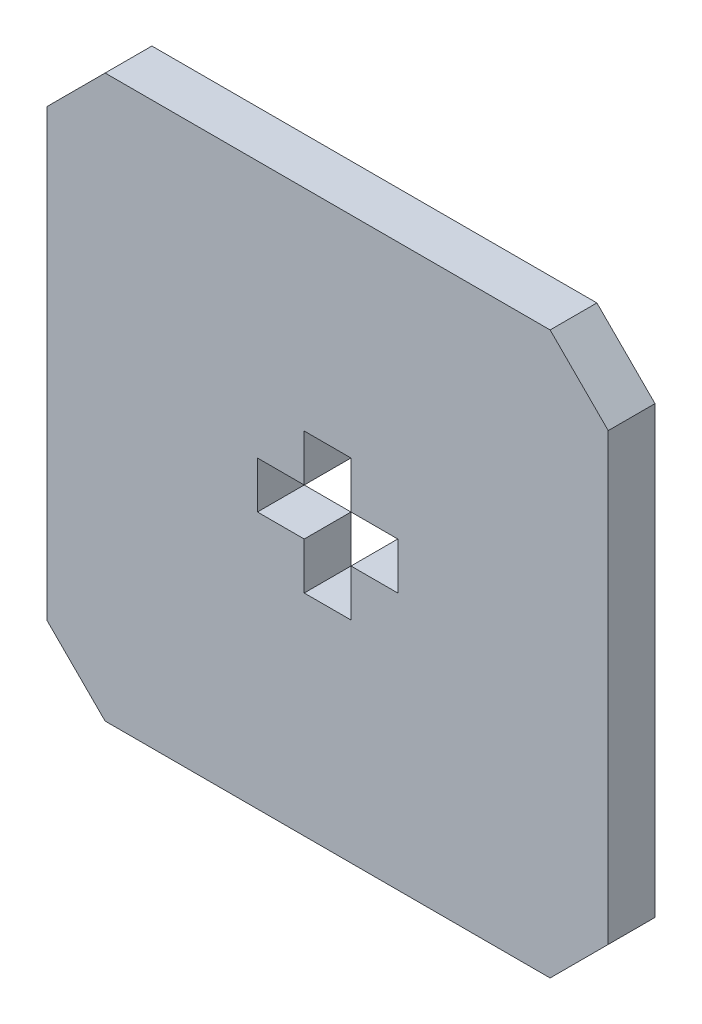
from build123d import *

# Parameters (mm, degrees)
BOSS_EXTRUDE1_DEPTH = 3


with BuildPart() as part:
    # Sketch1 → Boss-Extrude1 (new body)
    with BuildSketch(Plane.XY):
        Polygon((471.00000486, 293.272073149), (467.272082799, 296.99999521), (438.727926921, 296.99999521), (435.00000486, 293.272073149), (435.00000486, 264.727917272), (438.727926921, 260.99999521), (467.272082799, 260.99999521), (471.00000486, 264.727917272), align=None)
        Polygon((454.50000486, 274.49999521), (454.50000486, 277.49999521), (457.50000486, 277.49999521), (457.50000486, 280.49999521), (454.50000486, 280.49999521), (454.50000486, 283.49999521), (451.50000486, 283.49999521), (451.50000486, 280.49999521), (448.50000486, 280.49999521), (448.50000486, 277.49999521), (451.50000486, 277.49999521), (451.50000486, 274.49999521), align=None, mode=Mode.SUBTRACT)
    extrude(amount=BOSS_EXTRUDE1_DEPTH)


solid = part.part
